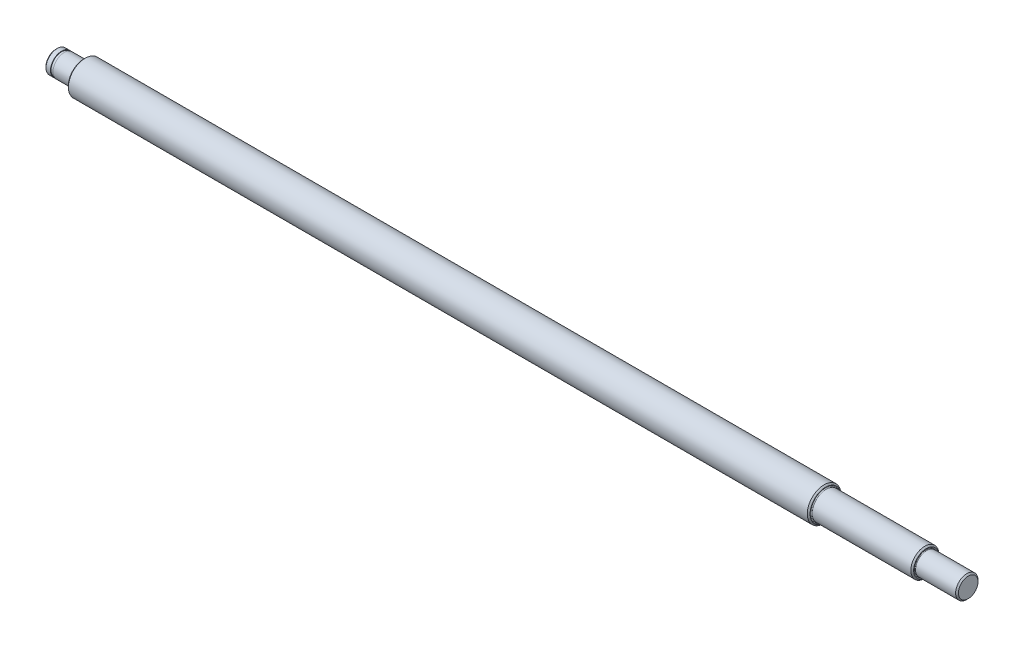
from build123d import *


with BuildPart() as part:
    # Sketch1 → Revolve1 (revolve)
    with BuildSketch(Plane.XY):
        with BuildLine():
            Line((2.1, 4), (2.1, 3.8))
            Line((2.1, 3.8), (3, 3.8))
            Line((3, 3.8), (3, 4))
            Line((3, 4), (9.7, 4))
            ThreePointArc((9.7, 4), (9.912132034, 4.087867966), (10, 4.3))
            Line((10, 4.3), (10, 5.5))
            Line((10, 5.5), (10.5, 6))
            Line((10.5, 6), (274.5, 6))
            Line((274.5, 6), (275, 5.5))
            Line((275, 5.5), (275, 5.3))
            ThreePointArc((275, 5.3), (275.087867966, 5.087867966), (275.3, 5))
            Line((275.3, 5), (310.5, 5))
            Line((310.5, 5), (311, 4.5))
            Line((311, 4.5), (311, 4.2))
            ThreePointArc((311, 4.2), (311.058578644, 4.058578644), (311.2, 4))
            Line((311.2, 4), (325.5, 4))
            Line((325.5, 4), (326, 3.5))
            Line((326, 3.5), (326, 0))
            Line((326, 0), (0, 0))
            Line((0, 0), (0, 3.5))
            Line((0, 3.5), (0.5, 4))
            Line((0.5, 4), (2.1, 4))
        make_face()
    revolve(axis=Axis((-20, 0, 0), (1, 0, 0)))


solid = part.part
